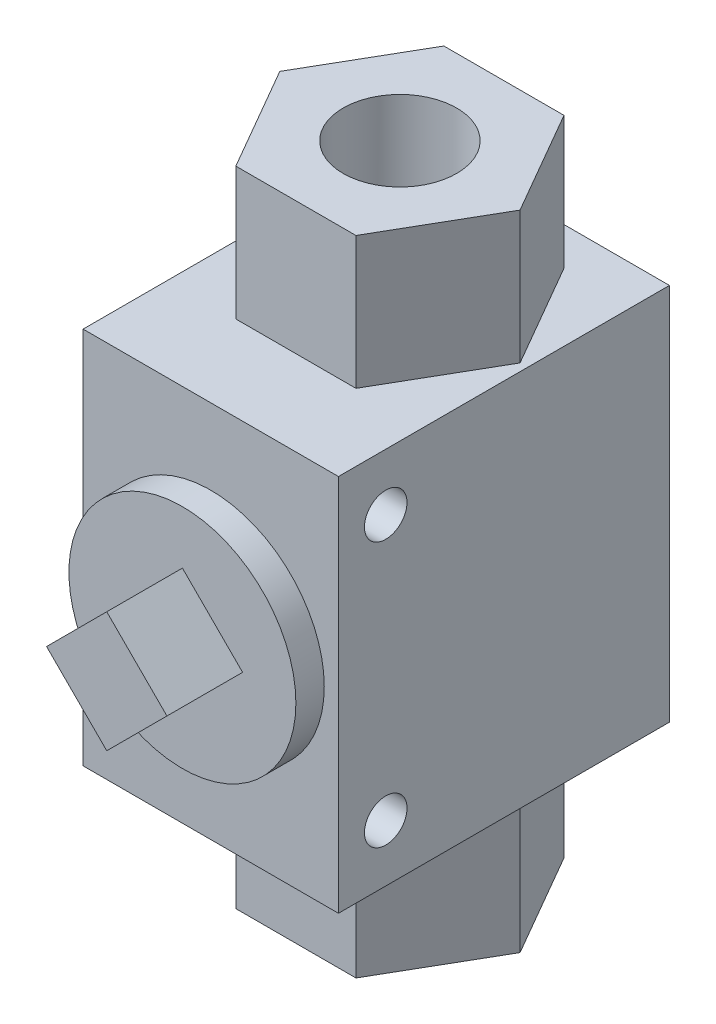
from build123d import *

# Parameters (mm, degrees)
SKETCH1_W                = 40
SKETCH1_H                = 35
SKETCH1_R                = 2.25
BOSS_EXTRUDE1_DEPTH      = 27
BOSS_EXTRUDE2_DEPTH      = 14
BOSS_EXTRUDE2_DEPTH_BACK = 54
SKETCH2_R                = 6
SKETCH3_R                = 12
BOSS_EXTRUDE3_DEPTH      = 3
BOSS_EXTRUDE4_DEPTH      = 8


with BuildPart() as part:
    # Sketch1 → Boss-Extrude1 (new body)
    with BuildSketch(Plane.YZ):
        Rectangle(SKETCH1_W, SKETCH1_H)
        with Locations(Location((-14, 12.5, 0), (0, 0, 270))):
            Circle(SKETCH1_R, mode=Mode.SUBTRACT)
        with Locations(Location((14, 12.5, 0), (0, 0, 270))):
            Circle(SKETCH1_R, mode=Mode.SUBTRACT)
    extrude(amount=BOSS_EXTRUDE1_DEPTH)

    # Sketch2 → Boss-Extrude2 (add, two sides: drawn at the far end of the back side and taken through both)
    with BuildSketch(Plane(origin=(0, 20, 0), x_dir=(-1, 0, 0), z_dir=(0, 1, 0)).offset(-BOSS_EXTRUDE2_DEPTH_BACK)):
        Polygon((-0.798294078, -2.5), (-7.149147039, 8.5), (-19.850852961, 8.5), (-26.201705922, -2.5), (-19.850852961, -13.5), (-7.149147039, -13.5), align=None)
        with Locations(Location((-13.5, -2.5, 0), (0, 0, 90))):
            Circle(SKETCH2_R, mode=Mode.SUBTRACT)
    extrude(amount=BOSS_EXTRUDE2_DEPTH + BOSS_EXTRUDE2_DEPTH_BACK)

    # Sketch3 → Boss-Extrude3 (add)
    with BuildSketch(Plane.XY.offset(17.5)):
        with Locations((13.5, 0)):
            Circle(SKETCH3_R)
    extrude(amount=BOSS_EXTRUDE3_DEPTH)

    # Sketch4 → Boss-Extrude4 (add)
    with BuildSketch(Plane.XY.offset(20.5)):
        Polygon((13.5, 6.363961031), (7.136038969, 0), (13.5, -6.363961031), (19.863961031, 0), align=None)
    extrude(amount=BOSS_EXTRUDE4_DEPTH)


solid = part.part
